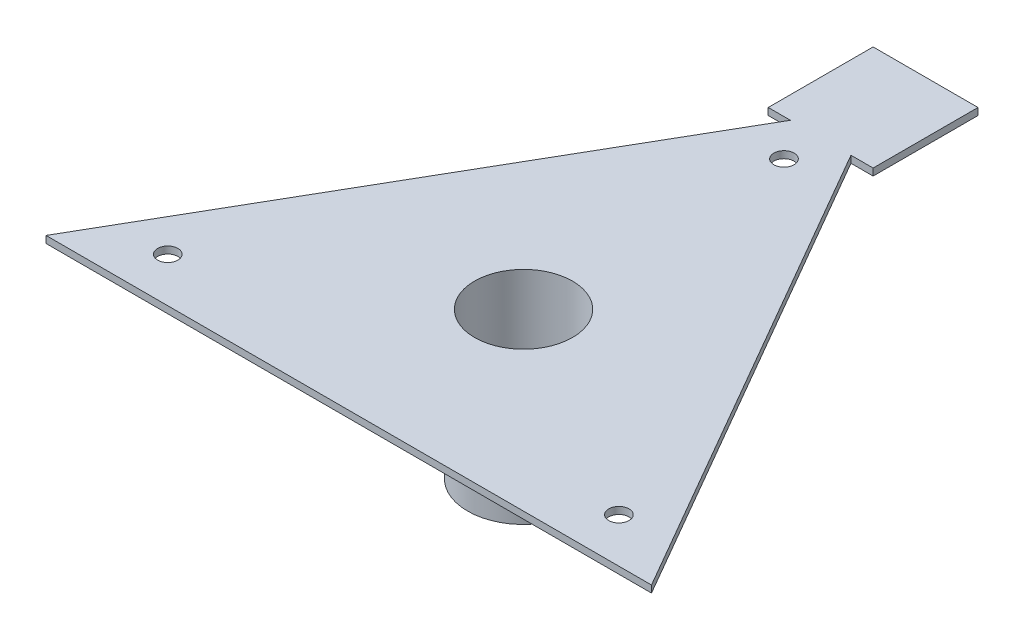
from build123d import *

# Parameters (mm, degrees)
BOSS_EXTRUDE3_DEPTH = 1.25
SKETCH5_R           = 1.45
CUT_EXTRUDE1_DEPTH  = 1.25
SKETCH6_R           = 8
BOSS_EXTRUDE6_DEPTH = 20
SKETCH8_R           = 6
CUT_EXTRUDE5_DEPTH  = 30
SKETCH9_R           = 7
CUT_EXTRUDE7_DEPTH  = 25
SKETCH10_R          = 52.083932338
CUT_EXTRUDE9_DEPTH  = 0.25
SKETCH11_W          = 15
SKETCH11_H          = 15
BOSS_EXTRUDE9_DEPTH = 1


with BuildPart() as part:
    # Sketch1 → Boss-Extrude3 (new body)
    with BuildSketch(Plane(origin=(0, 0, 0), x_dir=(1, 0, 0), z_dir=(0, 1, 0))):
        Polygon((0, 50), (43.301270189, -25), (0, 0), align=None)
        Polygon((0, 0), (0, 50), (-43.301270189, -25), align=None)
        Polygon((0, 0), (-43.301270189, -25), (43.301270189, -25), align=None)
    extrude(amount=BOSS_EXTRUDE3_DEPTH)

    # Sketch5 → Cut-Extrude1 (cut)
    with BuildSketch(Plane(origin=(0, 1.25, 0), x_dir=(1, 0, 0), z_dir=(0, 1, 0))):
        with Locations(Location((0, 37.25, 0), (0, 0, 270))):
            Circle(SKETCH5_R)
        with Locations(Location((-32.259446291, -18.625, 0), (0, 0, 270))):
            Circle(SKETCH5_R)
        with Locations(Location((32.259446291, -18.625, 0), (0, 0, 270))):
            Circle(SKETCH5_R)
    extrude(amount=-CUT_EXTRUDE1_DEPTH, mode=Mode.SUBTRACT)

    # Sketch6 → Boss-Extrude6 (add)
    with BuildSketch(Plane.XZ):
        with Locations(Location((0, 0, 0), (0, 0, 90))):
            Circle(SKETCH6_R)
    extrude(amount=BOSS_EXTRUDE6_DEPTH)

    # Sketch8 → Cut-Extrude5 (cut)
    with BuildSketch(Plane.XZ.offset(20)):
        with Locations(Location((0, 0, 0), (0, 0, 270))):
            Circle(SKETCH8_R)
    extrude(amount=-CUT_EXTRUDE5_DEPTH, mode=Mode.SUBTRACT)

    # Sketch9 → Cut-Extrude7 (cut)
    with BuildSketch(Plane.XZ.offset(20)):
        with Locations(Location((0, 0, 0), (0, 0, 270))):
            Circle(SKETCH9_R)
    extrude(amount=-CUT_EXTRUDE7_DEPTH, mode=Mode.SUBTRACT)

    # Sketch10 → Cut-Extrude9 (cut)
    with BuildSketch(Plane(origin=(0, 1.25, 0), x_dir=(1, 0, 0), z_dir=(0, 1, 0))):
        Circle(SKETCH10_R)
    extrude(amount=-CUT_EXTRUDE9_DEPTH, mode=Mode.SUBTRACT)

    # Sketch11 → Boss-Extrude9 (add)
    with BuildSketch(Plane.XZ):
        with Locations((0, -50)):
            Rectangle(SKETCH11_W, SKETCH11_H)
    extrude(amount=-BOSS_EXTRUDE9_DEPTH)


solid = part.part
